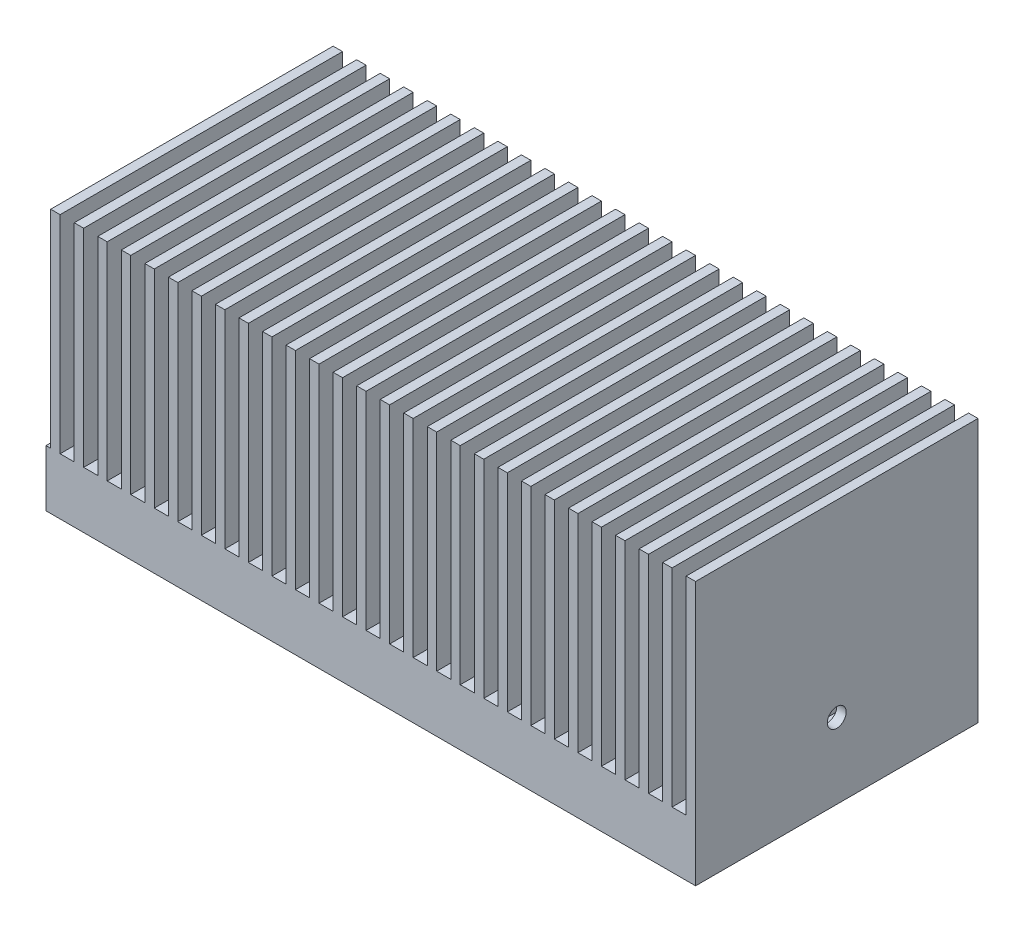
from build123d import *

# Parameters (mm, degrees)
SKETCH_1_W          = 69
SKETCH_1_H          = 30
EXTRUDE_1_DEPTH     = 28
SKETCH_2_W          = 1.5
SKETCH_2_H          = 30
CUT_EXTRUDE_1_DEPTH = 22
SKETCH_3_R          = 1
CUT_EXTRUDE_2_DEPTH = 5
CUT_EXTRUDE_START   = -5
SKETCH_4_R          = 1
CUT_EXTRUDE_3_DEPTH = 5


with BuildPart() as part:
    # 草图1 → 拉伸1 (new body)
    with BuildSketch(Plane(origin=(0, 0, 0), x_dir=(1, 0, 0), z_dir=(0, 1, 0))):
        Rectangle(SKETCH_1_W, SKETCH_1_H)
    extrude(amount=EXTRUDE_1_DEPTH)

    # 草图2 → 切除-拉伸1 (cut)
    with BuildSketch(Plane(origin=(0, 28, 0), x_dir=(-1, 0, 0), z_dir=(0, 1, 0))):
        with Locations((-0.25, 0)):
            Rectangle(SKETCH_2_W, SKETCH_2_H)
        with Locations((2.25, 0)):
            Rectangle(SKETCH_2_W, SKETCH_2_H)
        with Locations((4.75, 0)):
            Rectangle(SKETCH_2_W, SKETCH_2_H)
        with Locations((7.25, 0)):
            Rectangle(SKETCH_2_W, SKETCH_2_H)
        with Locations((9.75, 0)):
            Rectangle(SKETCH_2_W, SKETCH_2_H)
        with Locations((12.25, 0)):
            Rectangle(SKETCH_2_W, SKETCH_2_H)
        with Locations((14.75, 0)):
            Rectangle(SKETCH_2_W, SKETCH_2_H)
        with Locations((17.25, 0)):
            Rectangle(SKETCH_2_W, SKETCH_2_H)
        with Locations((19.75, 0)):
            Rectangle(SKETCH_2_W, SKETCH_2_H)
        with Locations((22.25, 0)):
            Rectangle(SKETCH_2_W, SKETCH_2_H)
        with Locations((24.75, 0)):
            Rectangle(SKETCH_2_W, SKETCH_2_H)
        with Locations((27.25, 0)):
            Rectangle(SKETCH_2_W, SKETCH_2_H)
        with Locations((29.75, 0)):
            Rectangle(SKETCH_2_W, SKETCH_2_H)
        with Locations((32.25, 0)):
            Rectangle(SKETCH_2_W, SKETCH_2_H)
        with Locations((34.75, 0)):
            Rectangle(SKETCH_2_W, SKETCH_2_H)
        with Locations((-2.75, 0)):
            Rectangle(SKETCH_2_W, SKETCH_2_H)
        with Locations((-5.25, 0)):
            Rectangle(SKETCH_2_W, SKETCH_2_H)
        with Locations((-7.75, 0)):
            Rectangle(SKETCH_2_W, SKETCH_2_H)
        with Locations((-10.25, 0)):
            Rectangle(SKETCH_2_W, SKETCH_2_H)
        with Locations((-12.75, 0)):
            Rectangle(SKETCH_2_W, SKETCH_2_H)
        with Locations((-15.25, 0)):
            Rectangle(SKETCH_2_W, SKETCH_2_H)
        with Locations((-17.75, 0)):
            Rectangle(SKETCH_2_W, SKETCH_2_H)
        with Locations((-20.25, 0)):
            Rectangle(SKETCH_2_W, SKETCH_2_H)
        with Locations((-22.75, 0)):
            Rectangle(SKETCH_2_W, SKETCH_2_H)
        with Locations((-25.25, 0)):
            Rectangle(SKETCH_2_W, SKETCH_2_H)
        with Locations((-27.75, 0)):
            Rectangle(SKETCH_2_W, SKETCH_2_H)
        with Locations((-30.25, 0)):
            Rectangle(SKETCH_2_W, SKETCH_2_H)
        with Locations((-32.75, 0)):
            Rectangle(SKETCH_2_W, SKETCH_2_H)
    extrude(amount=-CUT_EXTRUDE_1_DEPTH, mode=Mode.SUBTRACT)

    # 草图3 → 切除-拉伸2 (cut)
    with BuildSketch(Plane.ZY.offset(34)):
        with Locations((0, 8)):
            Circle(SKETCH_3_R)
    extrude(amount=-CUT_EXTRUDE_2_DEPTH, mode=Mode.SUBTRACT)

    # 草图4 → 切除-拉伸3 (cut)
    with BuildSketch(Plane(origin=(34.5, 0, 0), x_dir=(0, 0, -1), z_dir=(1, 0, 0)).offset(CUT_EXTRUDE_START)):
        with Locations(Location((0, 8, 0), (0, 0, 180))):
            Circle(SKETCH_4_R)
    extrude(amount=CUT_EXTRUDE_3_DEPTH, mode=Mode.SUBTRACT)


solid = part.part
